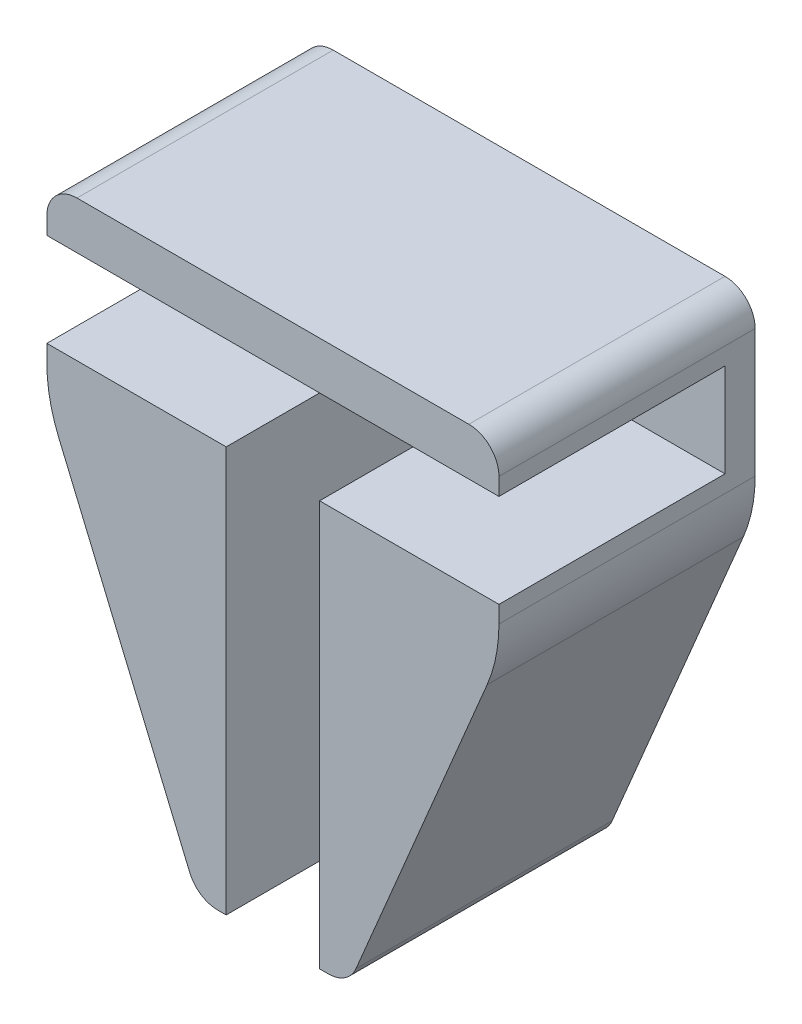
from build123d import *

# Parameters (mm, degrees)
DODANIE_WYCI_GNI_CIE1_DEPTH   = 15
DODANIE_WYCI_GNI_CIE1_2_DEPTH = 15
SZKIC1_W                      = 30
SZKIC1_H                      = 3.15
DODANIE_WYCI_GNI_CIE1_3_DEPTH = 15
DODANIE_WYCI_GNI_CIE2_DEPTH   = 2
ZAOKR_GLENIE1_R               = 10
ZAOKR_GLENIE2_R               = 2


with BuildPart() as part:
    # Szkic1 → Dodanie-wyciągnięcie1 (new body)
    with BuildSketch(Plane.XY):
        Polygon((-15, -6.25), (-5, -30), (-3.1, -30), (-3.1, -3.1), (-15, -3.1), align=None)
    extrude(amount=DODANIE_WYCI_GNI_CIE1_DEPTH)



with BuildPart() as body_2:
    # Szkic1 → Dodanie-wyci_gni_cie1 2 (new body)
    with BuildSketch(Plane.XY):
        Polygon((3.1, -3.1), (3.1, -30), (5, -30), (15, -6.25), (15, -3.1), align=None)
    extrude(amount=DODANIE_WYCI_GNI_CIE1_2_DEPTH)


with BuildPart() as body_3:
    # Szkic1 → Dodanie-wyci_gni_cie1 3 (new body)
    with BuildSketch(Plane.XY):
        with Locations((0, 4.675)):
            Rectangle(SZKIC1_W, SZKIC1_H)
    extrude(amount=DODANIE_WYCI_GNI_CIE1_3_DEPTH)


with BuildPart() as part_1:
    add(part.part)

    add(body_2.part)  # Dodanie-wyciągnięcie2 merges body 2

    add(body_3.part)  # Dodanie-wyciągnięcie2 merges body 3
    # Szkic1<3> → Dodanie-wyciągnięcie2 (add)
    with BuildSketch(Plane.XY):
        Polygon((-5, -30), (5, -30), (15, -6.25), (15, 6.25), (-15, 6.25), (-15, -6.25), align=None)
    extrude(amount=-DODANIE_WYCI_GNI_CIE2_DEPTH)

    # Zaokrąglenie1
    zaokr_glenie1_edges = [part_1.edges().sort_by_distance(p)[0] for p in [
        (-15, -6.25, 6.5),
        (15, -6.25, 6.5),
    ]]
    fillet(zaokr_glenie1_edges, radius=ZAOKR_GLENIE1_R)

    # Zaokrąglenie2
    zaokr_glenie2_edges = [part_1.edges().sort_by_distance(p)[0] for p in [
        (-15, 6.25, 6.5),
        (15, 6.25, 6.5),
        (-5, -30, 6.5),
        (5, -30, 6.5),
    ]]
    fillet(zaokr_glenie2_edges, radius=ZAOKR_GLENIE2_R)


solid = part_1.part
